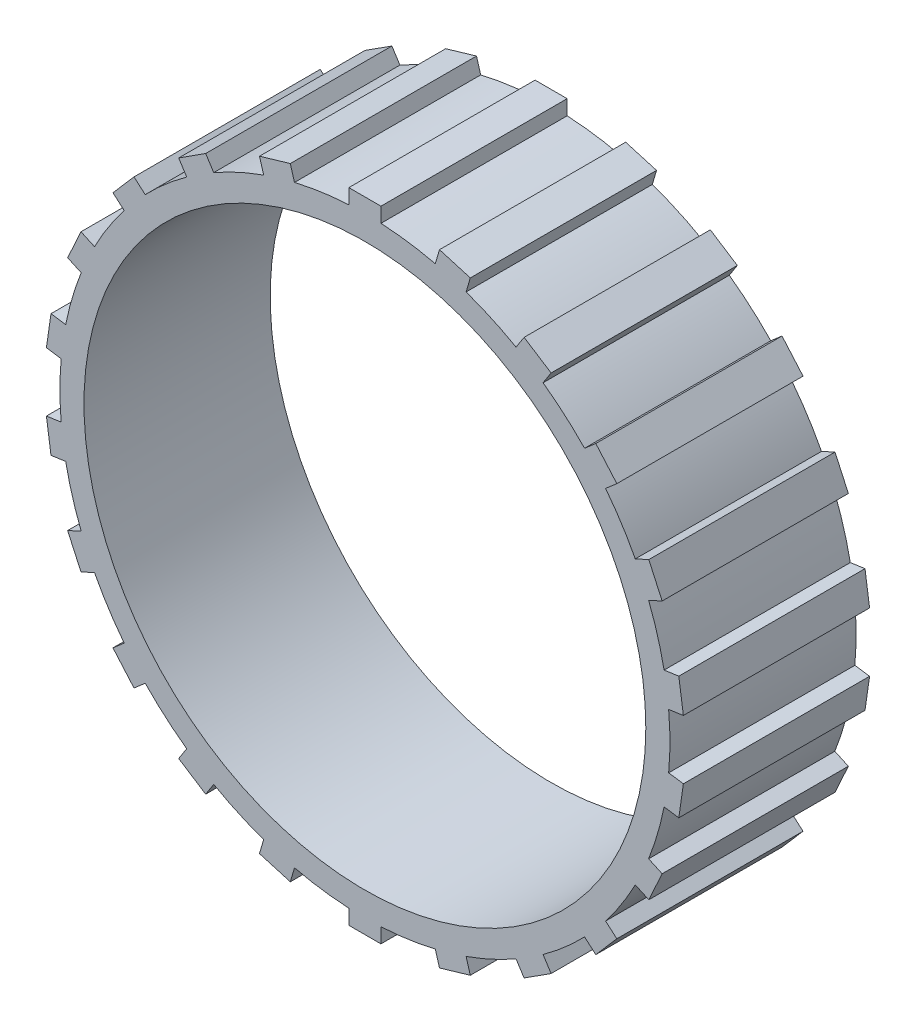
from build123d import *

# Parameters (mm, degrees)
SKETCH1_R           = 9.5
BOSS_EXTRUDE1_DEPTH = 5.8
SKETCH2_R           = 8.75
CUT_EXTRUDE1_DEPTH  = 5.8
SKETCH3_W           = 1
SKETCH3_H           = 1
BOSS_EXTRUDE2_DEPTH = 5.8


with BuildPart() as part:
    # Sketch1 → Boss-Extrude1 (new body)
    with BuildSketch(Plane.XY):
        with Locations((-43.212664647, 1.441865661)):
            Circle(SKETCH1_R)
    extrude(amount=BOSS_EXTRUDE1_DEPTH)

    # Sketch2 → Cut-Extrude1 (cut)
    with BuildSketch(Plane.XY.offset(5.8)):
        with Locations((-43.212664647, 1.441865661)):
            Circle(SKETCH2_R)
    extrude(amount=-CUT_EXTRUDE1_DEPTH, mode=Mode.SUBTRACT)

    # Sketch3 → Boss-Extrude2 (add)
    with BuildSketch(Plane.XY.offset(5.8)):
        Polygon((-40.889172194, 11.129687027), (-39.92967922, 10.84795447), (-40.211411777, 9.888461496), (-41.170904751, 10.170194053), align=None)
        with Locations((-43.212664647, 10.891865661)):
            Rectangle(SKETCH3_W, SKETCH3_H)
        Polygon((-38.25391528, 10.082658721), (-37.412661747, 9.542017904), (-37.953302565, 8.700764371), (-38.794556098, 9.241405188), align=None)
        Polygon((-36.02038675, 8.335604751), (-35.365526016, 7.579855176), (-36.12127559, 6.924994442), (-36.776136324, 7.680744017), align=None)
        Polygon((-34.3695338, 6.030061038), (-33.954118787, 5.120429043), (-34.863750783, 4.70501403), (-35.279165796, 5.614646025), align=None)
        Polygon((-33.43509872, 3.352809023), (-33.292783882, 2.362987581), (-34.282605324, 2.220672742), (-34.424920162, 3.210494184), align=None)
        Polygon((-33.292783882, 0.520743741), (-33.43509872, -0.469077701), (-34.424920162, -0.326762863), (-34.282605324, 0.663058579), align=None)
        Polygon((-33.954118787, -2.236697721), (-34.3695338, -3.146329716), (-35.279165796, -2.730914703), (-34.863750783, -1.821282708), align=None)
        Polygon((-35.365526016, -4.696123855), (-36.02038675, -5.451873429), (-36.776136324, -4.797012695), (-36.12127559, -4.041263121), align=None)
        Polygon((-37.412661747, -6.658286582), (-38.25391528, -7.1989274), (-38.794556098, -6.357673867), (-37.953302565, -5.817033049), align=None)
        Polygon((-39.92967922, -7.964223148), (-40.889172194, -8.245955705), (-41.170904751, -7.286462731), (-40.211411777, -7.004730175), align=None)
        with Locations((-43.212664647, -8.008134339)):
            Rectangle(SKETCH3_W, SKETCH3_H)
        Polygon((-45.536157101, -8.245955705), (-46.495650075, -7.964223148), (-46.213917518, -7.004730175), (-45.254424544, -7.286462731), align=None)
        Polygon((-48.171414015, -7.1989274), (-49.012667548, -6.658286582), (-48.47202673, -5.817033049), (-47.630773197, -6.357673867), align=None)
        Polygon((-50.404942545, -5.451873429), (-51.059803279, -4.696123855), (-50.304053705, -4.041263121), (-49.649192971, -4.797012695), align=None)
        Polygon((-52.055795495, -3.146329716), (-52.471210508, -2.236697721), (-51.561578512, -1.821282708), (-51.146163499, -2.730914703), align=None)
        Polygon((-52.990230575, -0.469077701), (-53.132545413, 0.520743741), (-52.142723971, 0.663058579), (-52.000409133, -0.326762863), align=None)
        Polygon((-53.132545413, 2.362987581), (-52.990230575, 3.352809023), (-52.000409133, 3.210494184), (-52.142723971, 2.220672742), align=None)
        Polygon((-52.471210508, 5.120429043), (-52.055795495, 6.030061038), (-51.146163499, 5.614646025), (-51.561578512, 4.70501403), align=None)
        Polygon((-51.059803279, 7.579855176), (-50.404942545, 8.335604751), (-49.649192971, 7.680744017), (-50.304053705, 6.924994442), align=None)
        Polygon((-49.012667548, 9.542017904), (-48.171414015, 10.082658721), (-47.630773197, 9.241405188), (-48.47202673, 8.700764371), align=None)
        Polygon((-46.495650075, 10.84795447), (-45.536157101, 11.129687027), (-45.254424544, 10.170194053), (-46.213917518, 9.888461496), align=None)
    extrude(amount=-BOSS_EXTRUDE2_DEPTH)


solid = part.part
